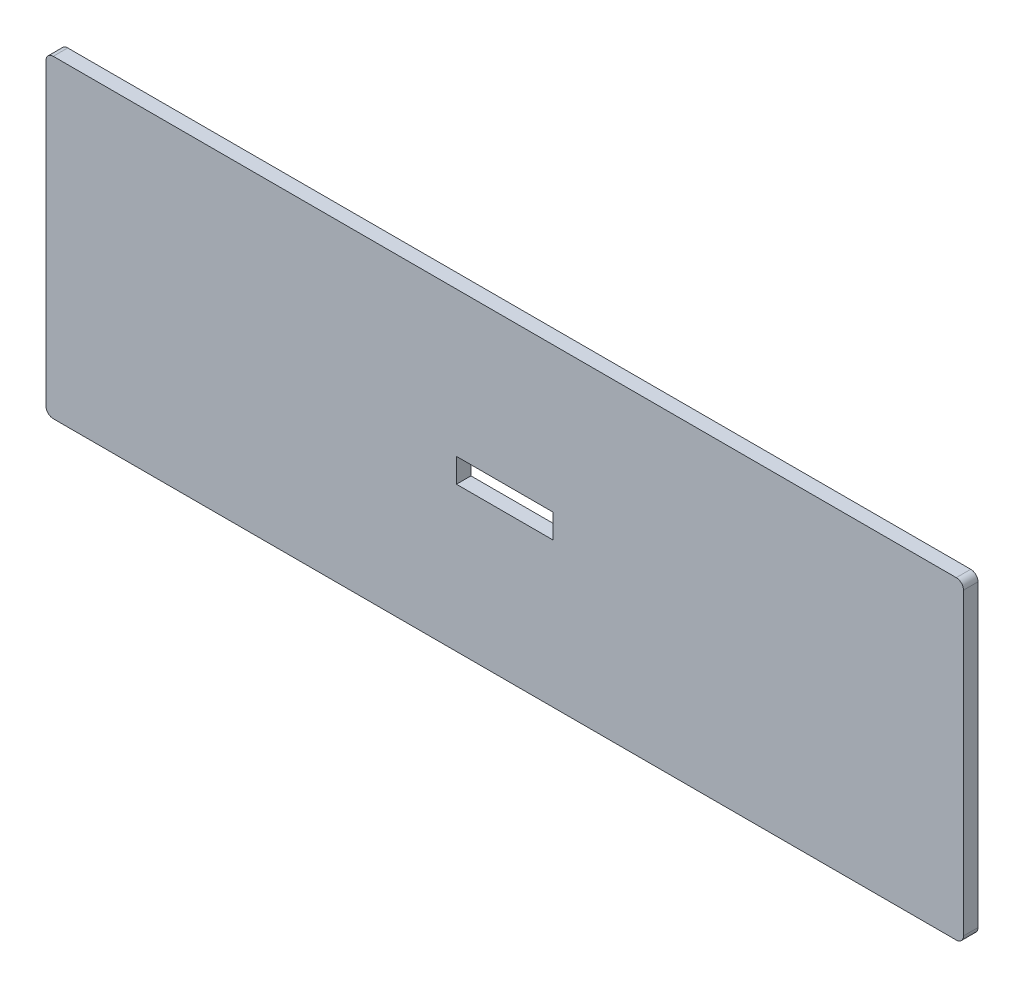
from build123d import *

# Parameters (mm, degrees)
SKETCH2_W           = 190
SKETCH2_H           = 65
SKETCH2_W_2         = 20
SKETCH2_H_2         = 5
BOSS_EXTRUDE1_DEPTH = 3
FILLET1_R           = 1.5


with BuildPart() as part:
    # Sketch2 → Boss-Extrude1 (new body)
    with BuildSketch(Plane.XY):
        with Locations((95, 32.5)):
            Rectangle(SKETCH2_W, SKETCH2_H)
        with Locations((95, 32.5)):
            Rectangle(SKETCH2_W_2, SKETCH2_H_2, mode=Mode.SUBTRACT)
    extrude(amount=BOSS_EXTRUDE1_DEPTH)

    # Fillet1
    fillet1_edges = [part.edges().sort_by_distance(p)[0] for p in [
        (0, 65, 1.5),
        (190, 65, 1.5),
        (190, 0, 1.5),
        (0, 0, 1.5),
    ]]
    fillet(fillet1_edges, radius=FILLET1_R)


solid = part.part
